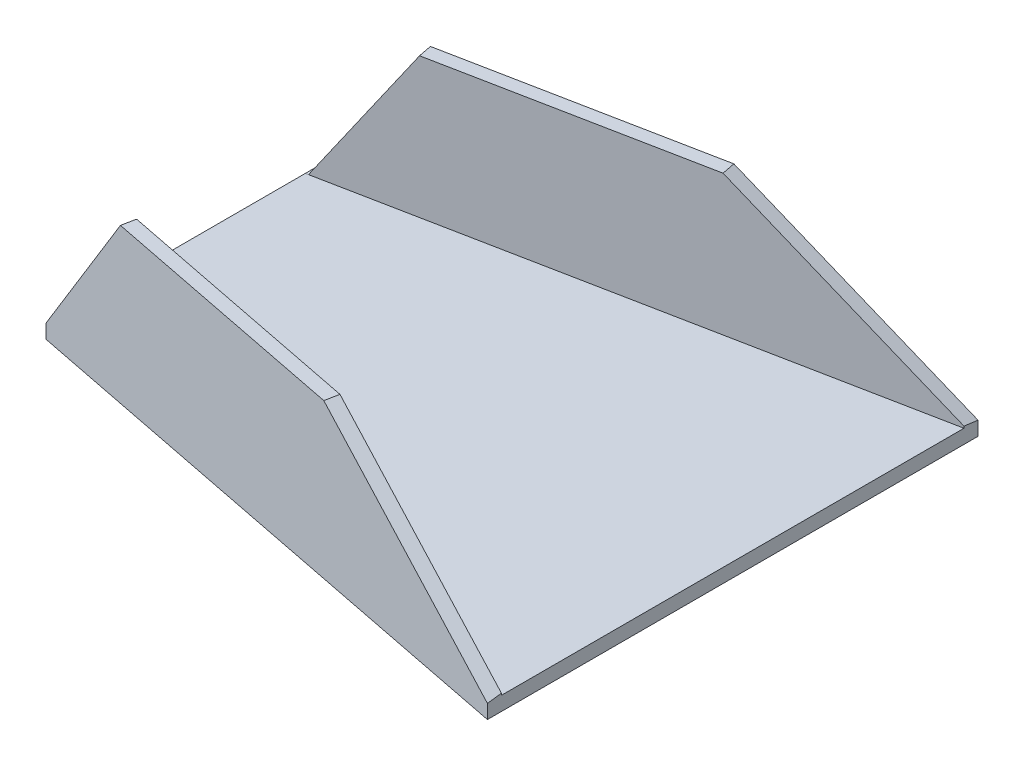
from build123d import *

# Parameters (mm, degrees)
BOSS_EXTRUDE1_DEPTH = 2
BOSS_EXTRUDE2_DEPTH = 20
CUT_EXTRUDE6_DEPTH  = 5
CUT_EXTRUDE7_DEPTH  = 5
CUT_EXTRUDE8_DEPTH  = 5
CUT_EXTRUDE9_DEPTH  = 5


with BuildPart() as part:
    # Sketch1 → Boss-Extrude1 (new body)
    with BuildSketch(Plane(origin=(0, 0, 0), x_dir=(1, 0, 0), z_dir=(0, 1, 0))):
        Polygon((0, 0), (0, -39), (78.484074818, -54.5), (78.484074818, 15.5), align=None)
    extrude(amount=BOSS_EXTRUDE1_DEPTH)

    # Sketch2 → Boss-Extrude2 (add)
    with BuildSketch(Plane(origin=(0, 2, 0), x_dir=(1, 0, 0), z_dir=(0, 1, 0))):
        Polygon((0, -39), (78.484074818, -54.5), (78.484074818, -52.5), (0, -37), align=None)
        Polygon((78.484074818, 15.5), (78.484074818, 13.5), (0, -2), (0, 0), align=None)
    extrude(amount=BOSS_EXTRUDE2_DEPTH)

    # Sketch3 → Cut-Extrude6 (cut)
    with BuildSketch(Plane(origin=(-7.413066129, 0, 37.535976563), x_dir=(0.98105093522202, 0, 0.19375000000000017), z_dir=(-0.19375000000000017, 0, 0.98105093522202))):
        Polygon((21.046420337, 22), (2.156848068, 22), (2.156848068, 2), (7.55625, 2), align=None)
    extrude(amount=-CUT_EXTRUDE6_DEPTH, mode=Mode.SUBTRACT)

    # Sketch4 → Cut-Extrude7 (cut)
    with BuildSketch(Plane(origin=(0, 0, 0), x_dir=(-0.98105093522202, 0, 0.1937499999999999), z_dir=(-0.19374999999999987, 0, -0.9810509352220199))):
        Polygon((-13.489984999, 22), (7.971845258, 22), (7.971845258, 2.000274775), (0, 2.000274775), align=None)
    extrude(amount=-CUT_EXTRUDE7_DEPTH, mode=Mode.SUBTRACT)

    # Sketch6 → Cut-Extrude8 (cut)
    with BuildSketch(Plane(origin=(-7.413066129, 0, 37.535976563), x_dir=(0.98105093522202, 0, 0.19375000000000017), z_dir=(-0.19375000000000017, 0, 0.98105093522202))):
        Polygon((57.90503063, 22), (98.623999419, 22), (98.623999419, 2), (87.55625, 2), align=None)
    extrude(amount=-CUT_EXTRUDE8_DEPTH, mode=Mode.SUBTRACT)

    # Sketch7 → Cut-Extrude9 (cut)
    with BuildSketch(Plane(origin=(0, 0, 0), x_dir=(-0.98105093522202, 0, 0.1937499999999999), z_dir=(-0.19374999999999987, 0, -0.9810509352220199))):
        Polygon((-50.34878063, 22), (-88.981830345, 22), (-88.981830345, 2), (-80, 2), align=None)
    extrude(amount=-CUT_EXTRUDE9_DEPTH, mode=Mode.SUBTRACT)


solid = part.part
